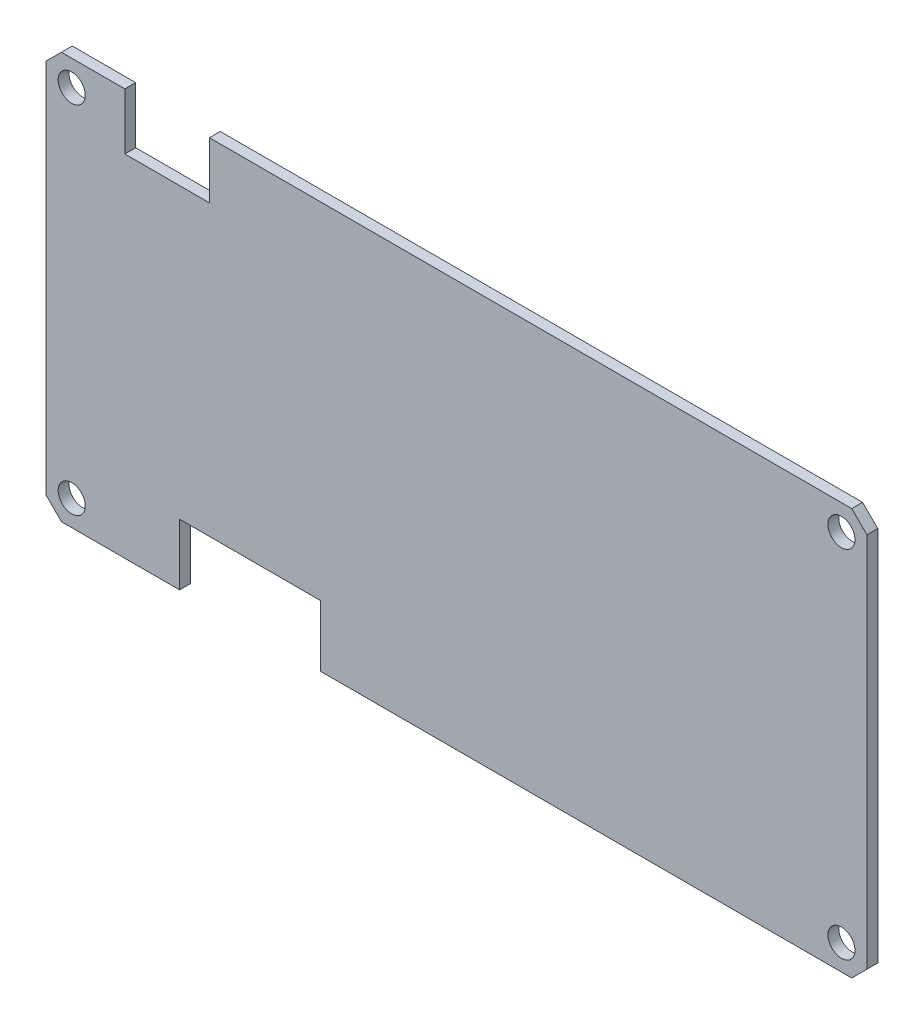
from build123d import *

# Parameters (mm, degrees)
SKETCH1_W                = 33.8
SKETCH1_H                = 37.5
BOSS_EXTRUDE_NOANT_DEPTH = 1
SKETCH2_W                = 41.9
SKETCH2_H                = 37.5
BOSS_EXTRUDE_ANT_DEPTH   = 1
SKETCH3_R                = 1.25
HOLES_DEPTH              = 46.914839649
CORNERS_DEPTH            = 46.914839649
SKETCH5_W                = 13
SKETCH5_H                = 5.65
CUT_EXTRUDE1_DEPTH       = 46.914839649
SKETCH6_W                = 7.8
SKETCH6_H                = 5.2
CUT_EXTRUDE2_DEPTH       = 46.914839649


with BuildPart() as part:
    # Sketch1 → Boss-Extrude-NoAnt (new body)
    with BuildSketch(Plane.XY):
        with Locations((-16.9, 0)):
            Rectangle(SKETCH1_W, SKETCH1_H)
    extrude(amount=BOSS_EXTRUDE_NOANT_DEPTH)

    # Sketch2 → Boss-Extrude-Ant (add)
    with BuildSketch(Plane.XY):
        with Locations((20.95, 0)):
            Rectangle(SKETCH2_W, SKETCH2_H)
    extrude(amount=BOSS_EXTRUDE_ANT_DEPTH)

    # Sketch3 → Holes (cut, through all)
    with BuildSketch(Plane(origin=(0, 0, 0), x_dir=(-1, 0, 0), z_dir=(0, 0, -1))):
        with Locations((31.45, -16.4)):
            Circle(SKETCH3_R)
        with Locations((-39.55, -16.4)):
            Circle(SKETCH3_R)
        with Locations((-39.55, 16.4)):
            Circle(SKETCH3_R)
        with Locations((31.45, 16.4)):
            Circle(SKETCH3_R)
    extrude(amount=-HOLES_DEPTH, mode=Mode.SUBTRACT)

    # Sketch4 → Corners (cut, through all)
    with BuildSketch(Plane(origin=(0, 0, 0), x_dir=(-1, 0, 0), z_dir=(0, 0, -1))):
        Polygon((-41.9, 18.75), (-40.5, 18.75), (-41.9, 17.35), align=None)
        Polygon((-41.9, -17.35), (-41.9, -18.75), (-40.5, -18.75), align=None)
        Polygon((33.8, -18.75), (32.4, -18.75), (33.8, -17.35), align=None)
        Polygon((33.8, 17.35), (33.8, 18.75), (32.4, 18.75), align=None)
    extrude(amount=-CORNERS_DEPTH, mode=Mode.SUBTRACT)

    # Sketch5 → Cut-Extrude1 (cut, through all)
    with BuildSketch(Plane.XY.offset(1)):
        with Locations((-15, -15.925)):
            Rectangle(SKETCH5_W, SKETCH5_H)
    extrude(amount=-CUT_EXTRUDE1_DEPTH, mode=Mode.SUBTRACT)

    # Sketch6 → Cut-Extrude2 (cut, through all)
    with BuildSketch(Plane(origin=(0, 0, 0), x_dir=(-1, 0, 0), z_dir=(0, 0, -1))):
        with Locations((22.65, 16.15)):
            Rectangle(SKETCH6_W, SKETCH6_H)
    extrude(amount=-CUT_EXTRUDE2_DEPTH, mode=Mode.SUBTRACT)


solid = part.part
